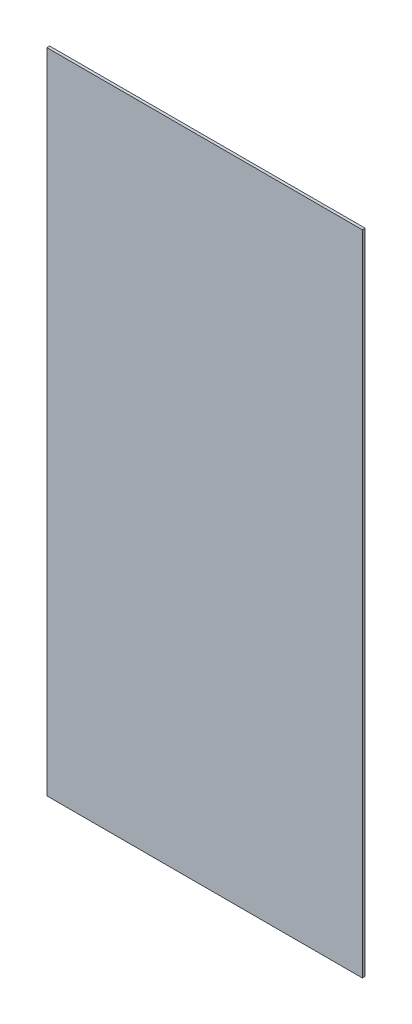
from build123d import *

# Parameters (mm, degrees)
SKETCH1_W      = 533.4
SKETCH1_H      = 1095.375
EXTRUDE1_DEPTH = 4.7625


with BuildPart() as part:
    # Sketch1 → Extrude1 (new body)
    with BuildSketch(Plane.XY):
        with Locations((266.7, 547.6875)):
            Rectangle(SKETCH1_W, SKETCH1_H)
    extrude(amount=EXTRUDE1_DEPTH)


solid = part.part
